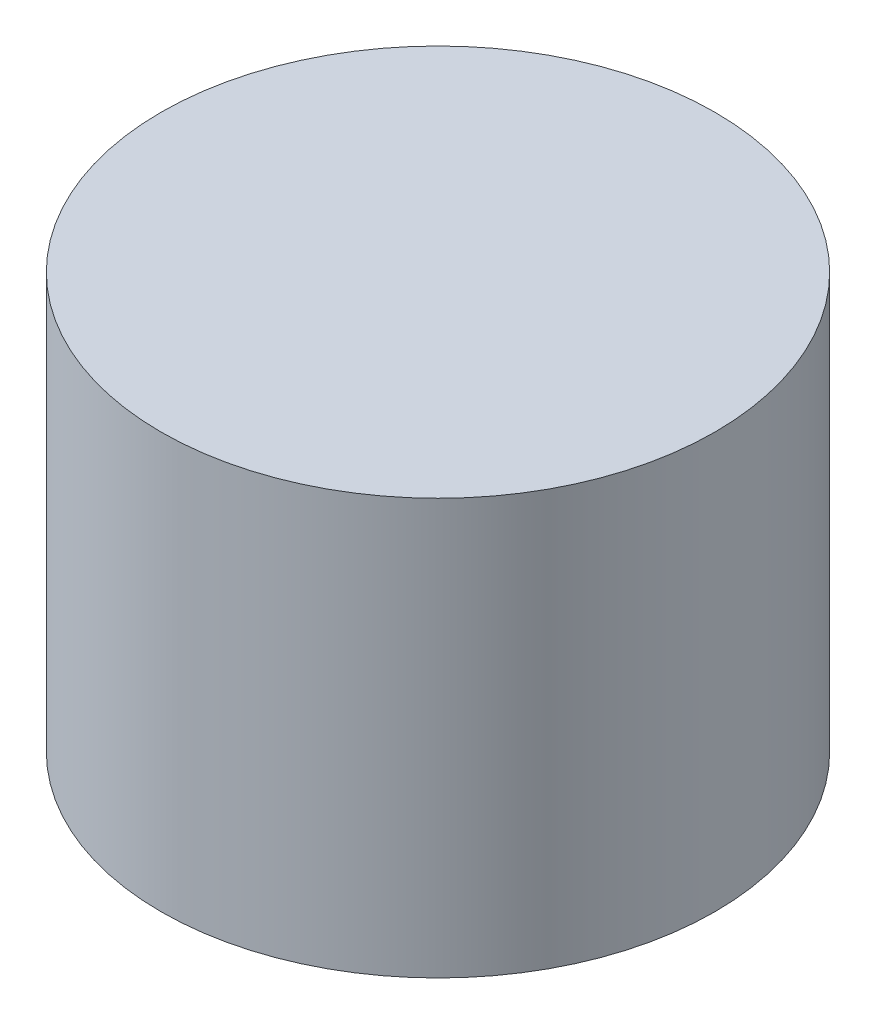
from build123d import *

# Parameters (mm, degrees)
SKETCH_1_R      = 30
EXTRUDE_1_DEPTH = 45


with BuildPart() as part:
    # 草图1 → 凸台-拉伸1 (new body)
    with BuildSketch(Plane(origin=(0, 0, 0), x_dir=(1, 0, 0), z_dir=(0, 1, 0))):
        with Locations(Location((0, 0, 0), (0, 0, 90))):
            Circle(SKETCH_1_R)
    extrude(amount=EXTRUDE_1_DEPTH)


solid = part.part
